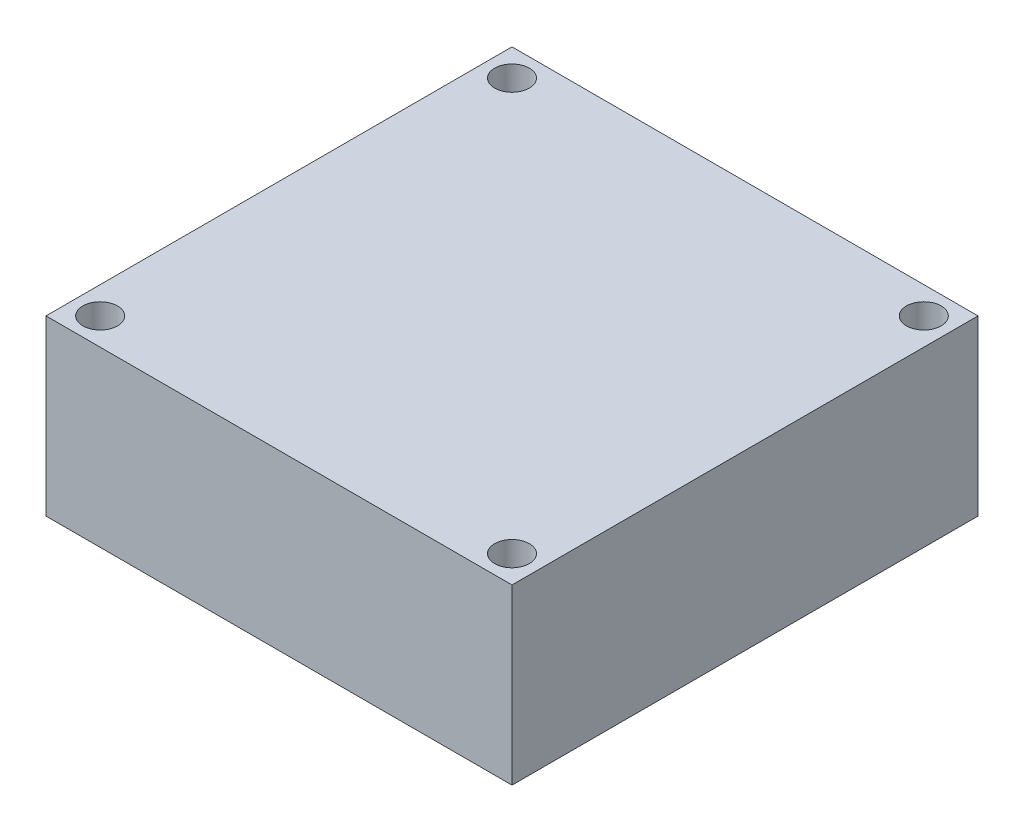
from build123d import *

# Parameters (mm, degrees)
SKETCH1_W            = 43
SKETCH1_H            = 43
BOSS_EXTRUDE1_DEPTH  = 16
M3_CLEARANCE_HOLE1_D = 3.2


with BuildPart() as part:
    # Sketch1 → Boss-Extrude1 (new body)
    with BuildSketch(Plane(origin=(0, 0, 0), x_dir=(1, 0, 0), z_dir=(0, 1, 0))):
        Rectangle(SKETCH1_W, SKETCH1_H)
    extrude(amount=BOSS_EXTRUDE1_DEPTH)

    # M3 Clearance Hole1 (through all)
    with Locations(Plane(origin=(0, 16, 0), x_dir=(1, 0, 0), z_dir=(0, 1, 0))):
        with Locations((-19, 19), (19, 19), (19, -19), (-19, -19)):
            Hole(M3_CLEARANCE_HOLE1_D / 2)


solid = part.part
